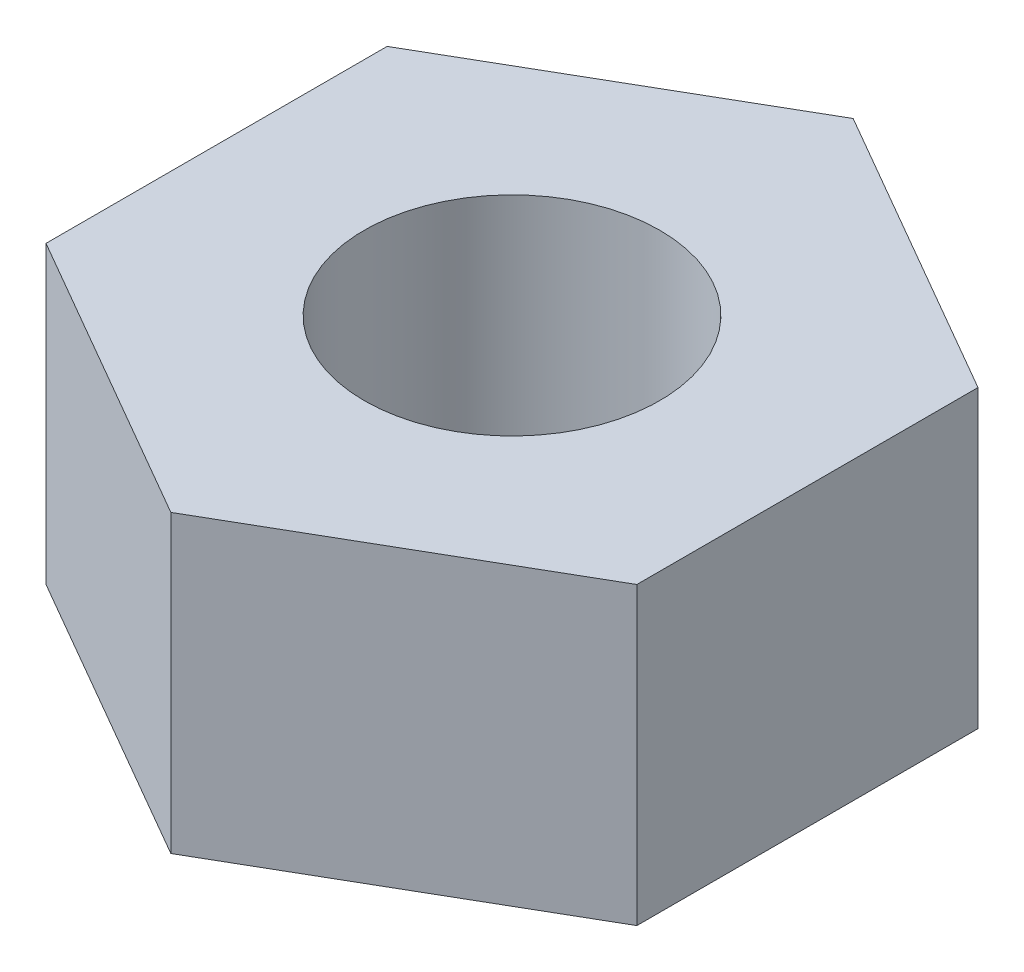
from build123d import *

# Parameters (mm, degrees)
SKETCH1_R           = 1.5
BOSS_EXTRUDE1_DEPTH = 3


with BuildPart() as part:
    # Sketch1 → Boss-Extrude1 (new body)
    with BuildSketch(Plane(origin=(0, 0, 0), x_dir=(1, 0, 0), z_dir=(0, 1, 0))):
        Polygon((0, 3.464101615), (-3, 1.732050808), (-3, -1.732050808), (0, -3.464101615), (3, -1.732050808), (3, 1.732050808), align=None)
        with Locations(Location((0, 0, 0), (0, 0, 270))):
            Circle(SKETCH1_R, mode=Mode.SUBTRACT)
    extrude(amount=BOSS_EXTRUDE1_DEPTH)


solid = part.part
